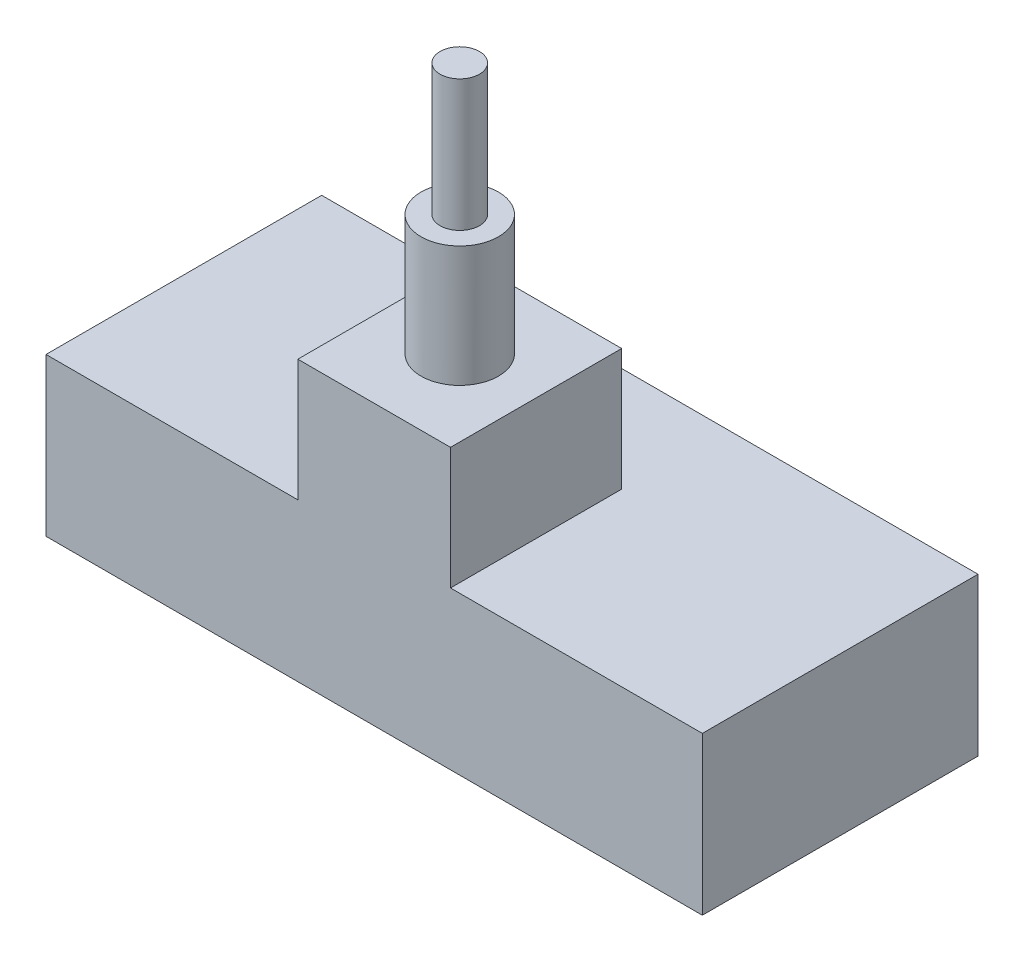
from build123d import *

# Parameters (mm, degrees)
SKETCH1_W           = 11.63
SKETCH1_H           = 13.04
BOSS_EXTRUDE1_DEPTH = 9.28
SKETCH2_W           = 50
SKETCH2_H           = 21
BOSS_EXTRUDE2_DEPTH = 12
SKETCH3_R           = 2.95
BOSS_EXTRUDE3_DEPTH = 9.2
SKETCH4_R           = 1.5
BOSS_EXTRUDE4_DEPTH = 10


with BuildPart() as part:
    # Sketch1 → Boss-Extrude1 (new body)
    with BuildSketch(Plane(origin=(0, 0, 0), x_dir=(1, 0, 0), z_dir=(0, 1, 0))):
        Rectangle(SKETCH1_W, SKETCH1_H)
    extrude(amount=BOSS_EXTRUDE1_DEPTH)

    # Sketch2 → Boss-Extrude2 (add)
    with BuildSketch(Plane.XZ):
        with Locations((0, -3.98)):
            Rectangle(SKETCH2_W, SKETCH2_H)
    extrude(amount=BOSS_EXTRUDE2_DEPTH)

    # Sketch3 → Boss-Extrude3 (add)
    with BuildSketch(Plane(origin=(0, 9.28, 0), x_dir=(1, 0, 0), z_dir=(0, 1, 0))):
        with Locations(Location((0, 0, 0), (0, 0, 90))):
            Circle(SKETCH3_R)
    extrude(amount=BOSS_EXTRUDE3_DEPTH)

    # Sketch4 → Boss-Extrude4 (add)
    with BuildSketch(Plane(origin=(0, 18.48, 0), x_dir=(1, 0, 0), z_dir=(0, 1, 0))):
        with Locations(Location((0, 0, 0), (0, 0, 270))):
            Circle(SKETCH4_R)
    extrude(amount=BOSS_EXTRUDE4_DEPTH)


solid = part.part
